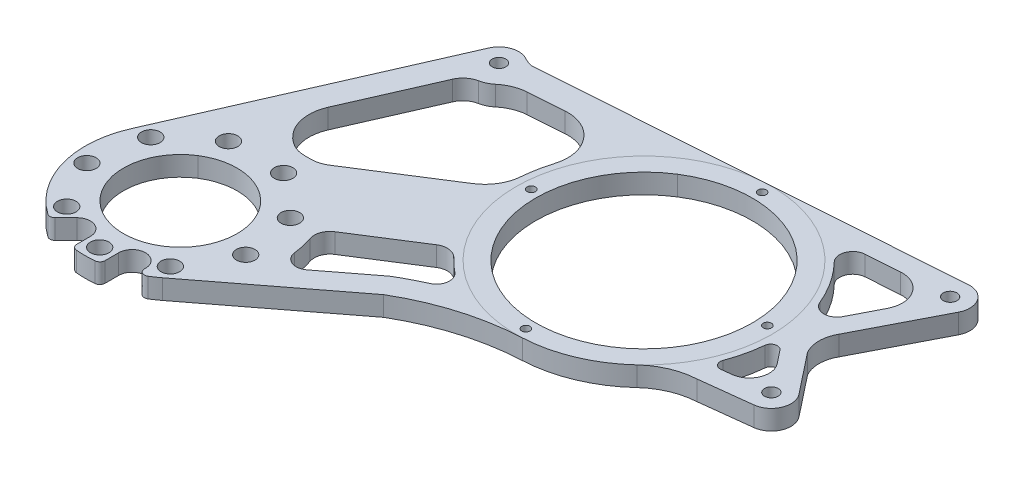
from build123d import *

# Parameters (mm, degrees)
SKETCH1_R                      = 27.4955
SKETCH1_R_2                    = 2
SKETCH1_R_3                    = 52.3875
SKETCH1_R_4                    = 3.3
BOSS_EXTRUDE1_DEPTH            = 9.525
M8_CLEARANCE_HOLE1_D           = 9
M8_CLEARANCE_HOLE1_CSINK_D     = 9.05
M8_CLEARANCE_HOLE1_CSINK_ANGLE = 90
CIRPATTERN1_COUNT              = 9
CUT_EXTRUDE2_DEPTH             = 705.952403184


with BuildPart() as part:
    # Sketch1 → Boss-Extrude1 (new body)
    with BuildSketch(Plane(origin=(0, 0, 0), x_dir=(-1, 0, 0), z_dir=(0, 1, 0))):
        with BuildLine():
            Line((-663.918846707, 4.476573271), (-466.57213203, 18.457038772))
            ThreePointArc((-466.57213203, 18.457038772), (-464.265511177, 17.802436421), (-462.085988967, 16.80309317))
            ThreePointArc((-462.085988967, 16.80309317), (-454.417575787, 16.107140218), (-448.740207572, 21.308717033))
            Line((-448.740207572, 21.308717033), (-396.041564291, 141.567674451))
            ThreePointArc((-396.041564291, 141.567674451), (-393.869824608, 172.384252636), (-411.692336104, 197.617881552))
            ThreePointArc((-411.692336104, 197.617881552), (-413.372500119, 198.071242365), (-414.950136715, 197.336701751))
            Line((-414.950136715, 197.336701751), (-420.215020333, 192.071818133))
            ThreePointArc((-420.215020333, 192.071818133), (-427.298656721, 190.662795249), (-431.31121441, 196.668012211))
            Line((-431.31121441, 196.668012211), (-431.31121441, 203.240745001))
            ThreePointArc((-431.31121441, 203.240745001), (-431.968379704, 204.945600851), (-433.59982344, 205.768273949))
            ThreePointArc((-433.59982344, 205.768273949), (-438.15, 205.994), (-442.70017656, 205.768273949))
            ThreePointArc((-442.70017656, 205.768273949), (-444.331620296, 204.945600851), (-444.98878559, 203.240745001))
            Line((-444.98878559, 203.240745001), (-444.98878559, 196.668012211))
            ThreePointArc((-444.98878559, 196.668012211), (-451.48878559, 190.168012211), (-457.98878559, 196.668012211))
            Line((-457.98878559, 196.668012211), (-457.98878559, 197.245022653))
            ThreePointArc((-457.98878559, 197.245022653), (-459.278285753, 199.455870942), (-461.837486501, 199.421924563))
            ThreePointArc((-461.837486501, 199.421924563), (-464.019895008, 198.024699819), (-466.120112298, 196.506730383))
            Line((-466.120112298, 196.506730383), (-526.629683433, 150.121113421))
            ThreePointArc((-526.629683433, 150.121113421), (-551.530592574, 139.247052869), (-578.312485484, 134.661130809))
            ThreePointArc((-578.312485484, 134.661130809), (-599.244289514, 129.920579306), (-617.300018038, 118.318686532))
            ThreePointArc((-617.300018038, 118.318686532), (-626.772573796, 112.207783301), (-637.753125569, 109.658286556))
            Line((-637.753125569, 109.658286556), (-662.485690794, 106.73386739))
            ThreePointArc((-662.485690794, 106.73386739), (-670.168377129, 100.916938085), (-668.842832121, 91.372134981))
            Line((-668.842832121, 91.372134981), (-653.346537148, 71.746276485))
            ThreePointArc((-653.346537148, 71.746276485), (-651.347572908, 64.158994024), (-653.346537148, 56.571711562))
            Line((-653.346537148, 56.571711562), (-673.057822329, 18.34288652))
            ThreePointArc((-673.057822329, 18.34288652), (-672.544957076, 8.73610108), (-663.918846707, 4.476573271))
        make_face()
        with Locations(Location((-438.15, 160.02, 0), (0, 0, 270))):
            Circle(SKETCH1_R, mode=Mode.SUBTRACT)
        with Locations(Location((-632.402453753, 70.257452317, 0), (0, 0, 270))):
            Circle(SKETCH1_R_2, mode=Mode.SUBTRACT)
        with Locations(Location((-575.31, 72.821477372, 0), (0, 0, 270))):
            Circle(SKETCH1_R_3, mode=Mode.SUBTRACT)
        with Locations(Location((-661.367230642, 97.274762153, 0), (0, 0, 270))):
            Circle(SKETCH1_R_4, mode=Mode.SUBTRACT)
        with Locations(Location((-664.591931322, 13.977761728, 0), (0, 0, 270))):
            Circle(SKETCH1_R_4, mode=Mode.SUBTRACT)
        with Locations(Location((-457.464330992, 25.131712658, 0), (0, 0, 270))):
            Circle(SKETCH1_R_4, mode=Mode.SUBTRACT)
        with BuildLine():
            ThreePointArc((-518.217546247, 72.257452317), (-520.217546247, 70.257452317), (-518.217546247, 68.257452317))
            ThreePointArc((-518.217546247, 68.257452317), (-516.217546247, 70.257452317), (-518.217546247, 72.257452317))
        make_face(mode=Mode.SUBTRACT)
        with BuildLine():
            ThreePointArc((-575.31, 17.671477372), (-577.31, 15.671477372), (-575.31, 13.671477372))
            ThreePointArc((-575.31, 13.671477372), (-573.31, 15.671477372), (-575.31, 17.671477372))
        make_face(mode=Mode.SUBTRACT)
        with BuildLine():
            ThreePointArc((-575.31, 131.971477372), (-577.31, 129.971477372), (-575.31, 127.971477372))
            ThreePointArc((-575.31, 127.971477372), (-573.31, 129.971477372), (-575.31, 131.971477372))
        make_face(mode=Mode.SUBTRACT)
    extrude(amount=BOSS_EXTRUDE1_DEPTH)

    # M8 Clearance Hole1 (through all)
    with Locations(Plane(origin=(0, 0, 0), x_dir=(-1, 0, 0), z_dir=(0, -1, 0))):
        with Locations((-438.15, -199.019999978)):
            m8_clearance_hole1 = CounterSinkHole(M8_CLEARANCE_HOLE1_D / 2, M8_CLEARANCE_HOLE1_CSINK_D / 2, counter_sink_angle=M8_CLEARANCE_HOLE1_CSINK_ANGLE)

    # CirPattern1: M8 Clearance Hole1 ×9 about axis
    cirpattern1_axis = Axis((438.15, 0, 160.02), (0, 1, 0))
    for i in range(1, CIRPATTERN1_COUNT):
        add(m8_clearance_hole1.rotate(cirpattern1_axis, i * 360 / CIRPATTERN1_COUNT), mode=Mode.SUBTRACT)

    # Sketch10 → Cut-Extrude2 (cut, through all)
    with BuildSketch(Plane.XZ):
        with BuildLine():
            Line((459.226572507, 108.99771107), (501.653528527, 82.025066826))
            ThreePointArc((501.653528527, 82.025066826), (507.74174649, 75.794215969), (510.419523322, 67.504498748))
            ThreePointArc((510.419523322, 67.504498748), (511.358943513, 60.602369407), (513.030374645, 53.840105163))
            ThreePointArc((513.030374645, 53.840105163), (509.706018745, 36.414131356), (493.461745749, 29.283949023))
            Line((493.461745749, 29.283949023), (476.484388236, 30.486661525))
            ThreePointArc((476.484388236, 30.486661525), (470.70159957, 31.823239298), (465.610821582, 34.87464297))
            ThreePointArc((465.610821582, 34.87464297), (462.940510841, 36.590397323), (459.928151148, 37.590428091))
            ThreePointArc((459.928151148, 37.590428091), (455.812610468, 39.507256825), (453.051892844, 43.11146904))
            Line((453.051892844, 43.11146904), (434.678898983, 85.038868854))
            ThreePointArc((434.678898983, 85.038868854), (434.121445197, 98.905571071), (443.119806681, 109.470876354))
            ThreePointArc((443.119806681, 109.470876354), (446.028863873, 110.597089782), (449.124699442, 110.980198854))
            Line((449.124699442, 110.980198854), (452.412988142, 110.980198854))
            ThreePointArc((452.412988142, 110.980198854), (455.961057678, 110.474509108), (459.226572507, 108.99771107))
        make_face()
        with BuildLine():
            Line((488.447021855, 135.568616467), (518.5458141, 116.433517192))
            ThreePointArc((518.5458141, 116.433517192), (523.526027217, 115.31070897), (528.083819046, 117.610655627))
            ThreePointArc((528.083819046, 117.610655627), (531.194244853, 120.677331811), (534.503353276, 123.528481221))
            ThreePointArc((534.503353276, 123.528481221), (536.820485804, 129.284400418), (533.124064721, 134.267991506))
            ThreePointArc((533.124064721, 134.267991506), (526.661398117, 137.399578344), (520.391516426, 140.901217866))
            Line((520.391516426, 140.901217866), (497.676544793, 158.314132116))
            ThreePointArc((497.676544793, 158.314132116), (491.351665893, 159.127989595), (487.50938857, 154.038455032))
            ThreePointArc((487.50938857, 154.038455032), (486.663269024, 149.130057447), (485.330309415, 144.330942547))
            ThreePointArc((485.330309415, 144.330942547), (485.381225421, 139.4135911), (488.447021855, 135.568616467))
        make_face()
        with BuildLine():
            Line((639.635942668, 99.844305363), (644.459248163, 99.273989793))
            ThreePointArc((644.459248163, 99.273989793), (652.141934498, 93.457060489), (650.81638949, 83.912257385))
            Line((650.81638949, 83.912257385), (645.741529497, 77.485012402))
            ThreePointArc((645.741529497, 77.485012402), (642.355366484, 76.406104411), (640.089678042, 79.144132587))
            ThreePointArc((640.089678042, 79.144132587), (638.723930439, 87.486267946), (636.288558775, 95.581047358))
            ThreePointArc((636.288558775, 95.581047358), (636.765902184, 98.652013793), (639.635942668, 99.844305363))
        make_face()
        with BuildLine():
            Line((646.905882736, 48.27876498), (654.235681435, 34.063071304))
            ThreePointArc((654.235681435, 34.063071304), (653.551861098, 21.25402405), (642.050380606, 15.574653638))
            Line((642.050380606, 15.574653638), (626.09624364, 16.704878997))
            ThreePointArc((626.09624364, 16.704878997), (620.612206918, 20.775189015), (621.990747453, 27.464113323))
            ThreePointArc((621.990747453, 27.464113323), (629.655675988, 37.003462943), (635.399559362, 47.808930282))
            ThreePointArc((635.399559362, 47.808930282), (641.002883392, 51.713394678), (646.905882736, 48.27876498))
        make_face()
    extrude(amount=-CUT_EXTRUDE2_DEPTH, mode=Mode.SUBTRACT)


solid = part.part
